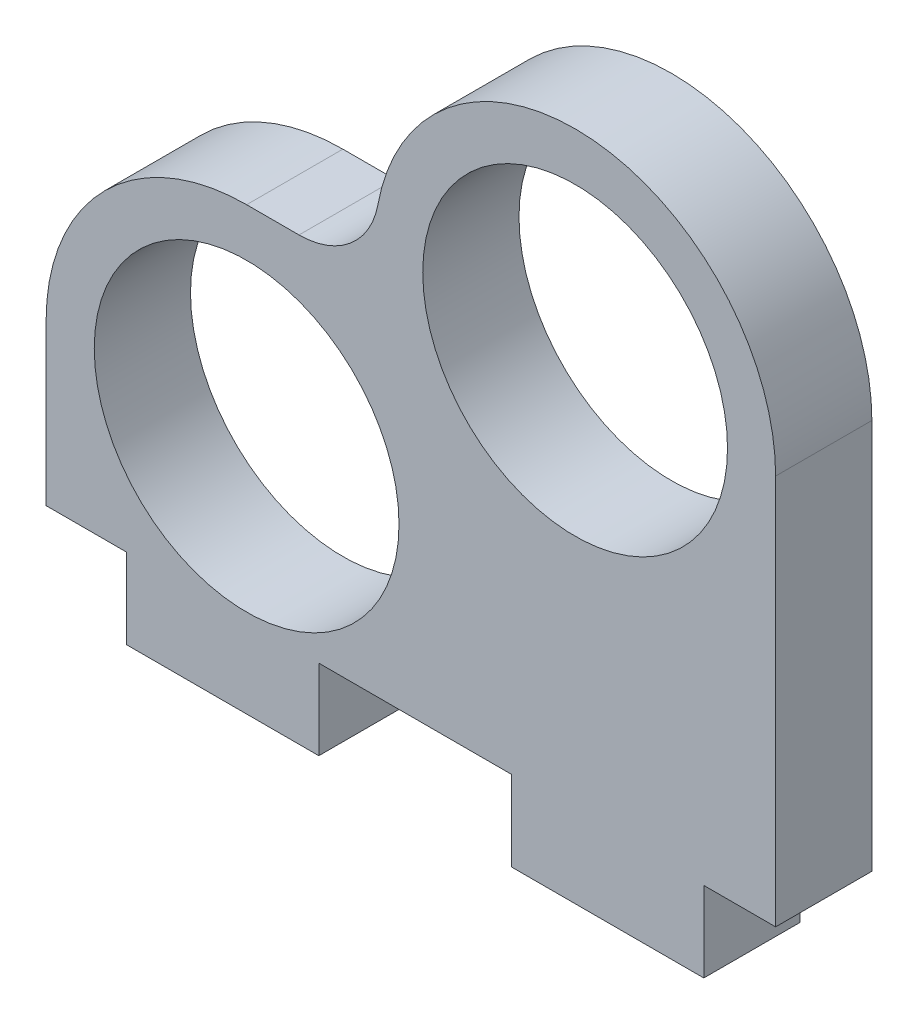
from build123d import *

# Parameters (mm, degrees)
CROQUIS1_R              = 9.5
SALIENTE_EXTRUIR1_DEPTH = 6


with BuildPart() as part:
    # Croquis1 → Saliente-Extruir1 (new body)
    with BuildSketch(Plane.XY):
        with BuildLine():
            Line((-12.5, 0), (-12.5, -10))
            Line((-12.5, -10), (-7.5, -10))
            Line((-7.5, -10), (-7.5, -15))
            Line((-7.5, -15), (4.5, -15))
            Line((4.5, -15), (4.5, -10))
            Line((4.5, -10), (16.5, -10))
            Line((16.5, -10), (16.5, -15))
            Line((16.5, -15), (28.5, -15))
            Line((28.5, -15), (28.5, -10))
            Line((28.5, -10), (32.978801107, -10))
            Line((32.978801107, -10), (32.978801107, 14.339410909))
            ThreePointArc((32.978801107, 14.339410909), (21.612252248, 26.787916382), (8.184354945, 16.596974545))
            ThreePointArc((8.184354945, 16.596974545), (6.46695714, 13.658442551), (3.266576481, 12.5))
            Line((3.266576481, 12.5), (0, 12.5))
            ThreePointArc((0, 12.5), (-8.838834765, 8.838834765), (-12.5, 0))
        make_face()
        Circle(CROQUIS1_R, mode=Mode.SUBTRACT)
        with Locations((20.478801107, 14.339410909)):
            Circle(CROQUIS1_R, mode=Mode.SUBTRACT)
    extrude(amount=SALIENTE_EXTRUIR1_DEPTH)


solid = part.part
